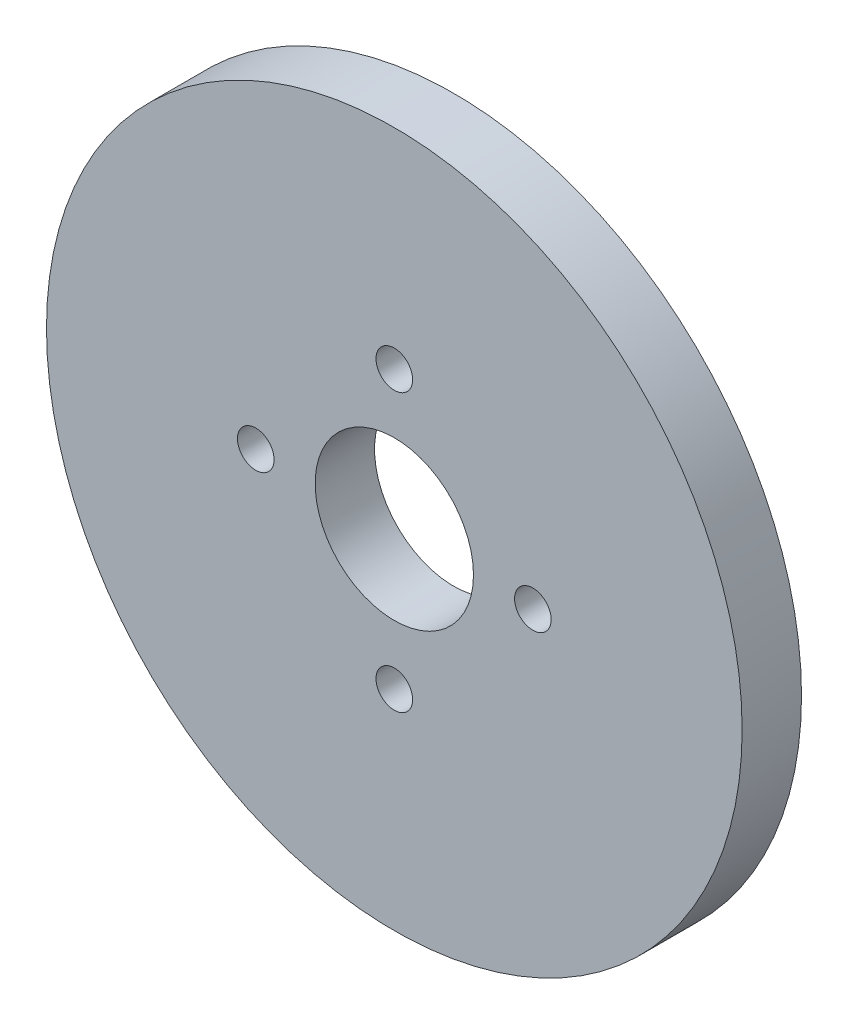
from build123d import *

# Parameters (mm, degrees)
ESQUISSE1_R        = 17.575
ESQUISSE1_R_2      = 0.925
ESQUISSE1_R_3      = 4
BOSS_EXTRU_1_DEPTH = 3


with BuildPart() as part:
    # Esquisse1 → Boss.-Extru.1 (new body)
    with BuildSketch(Plane.XY):
        Circle(ESQUISSE1_R)
        with Locations((7, 0)):
            Circle(ESQUISSE1_R_2, mode=Mode.SUBTRACT)
        with Locations((0, -7)):
            Circle(ESQUISSE1_R_2, mode=Mode.SUBTRACT)
        with Locations((-7, 0)):
            Circle(ESQUISSE1_R_2, mode=Mode.SUBTRACT)
        with Locations((0, 7)):
            Circle(ESQUISSE1_R_2, mode=Mode.SUBTRACT)
        Circle(ESQUISSE1_R_3, mode=Mode.SUBTRACT)
    extrude(amount=BOSS_EXTRU_1_DEPTH)


solid = part.part
